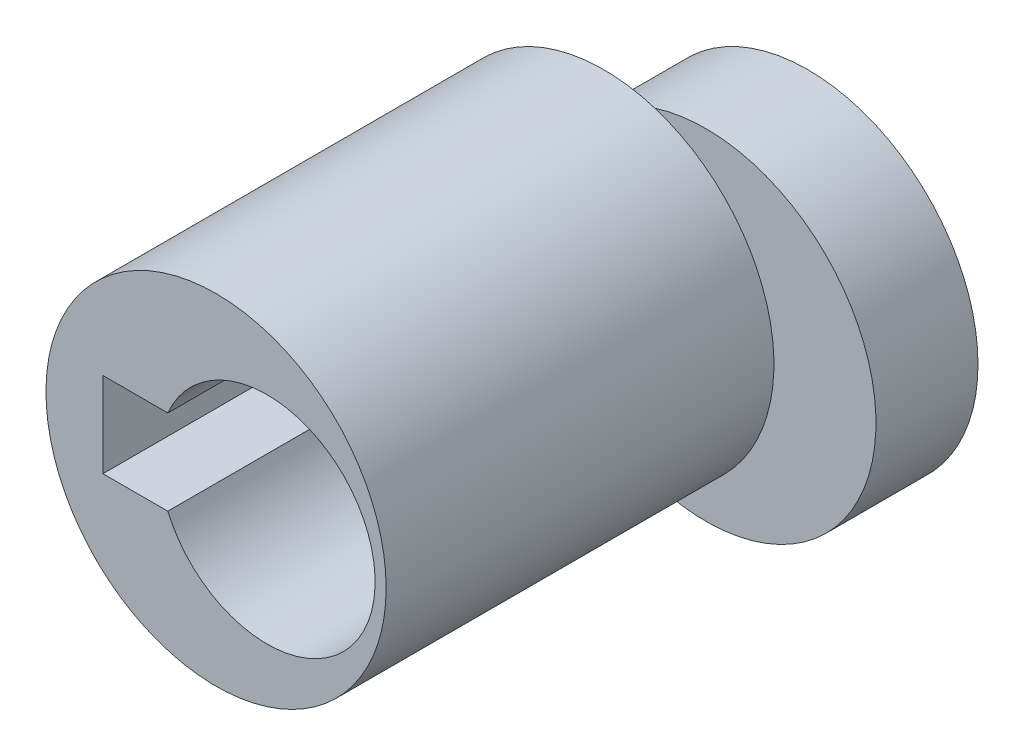
from build123d import *

# Parameters (mm, degrees)
SKETCH_1_R          = 10
EXTRUDE_1_DEPTH     = 6
SKETCH_2_R          = 10
EXTRUDE_2_DEPTH     = 22.8
CUT_EXTRUDE_1_DEPTH = 13


with BuildPart() as part:
    # 草图1 → 凸台-拉伸1 (new body)
    with BuildSketch(Plane.XY):
        Circle(SKETCH_1_R)
    extrude(amount=EXTRUDE_1_DEPTH)

    # 草图2 → 凸台-拉伸2 (add)
    with BuildSketch(Plane.XY.offset(6)):
        with Locations(Location((-6, 0, 0), (0, 0, 287.457603124))):
            Circle(SKETCH_2_R)
    extrude(amount=EXTRUDE_2_DEPTH)

    # 草图3 → 切除-拉伸1 (cut)
    with BuildSketch(Plane.XY.offset(28.8)):
        with BuildLine():
            Line((-12.65, 2.5), (-8.837165408, 2.5))
            ThreePointArc((-8.837165408, 2.5), (3.35, 0), (-8.837165408, -2.5))
            Line((-8.837165408, -2.5), (-12.65, -2.5))
            Line((-12.65, -2.5), (-12.65, 2.5))
        make_face()
    extrude(amount=-CUT_EXTRUDE_1_DEPTH, mode=Mode.SUBTRACT)


solid = part.part
